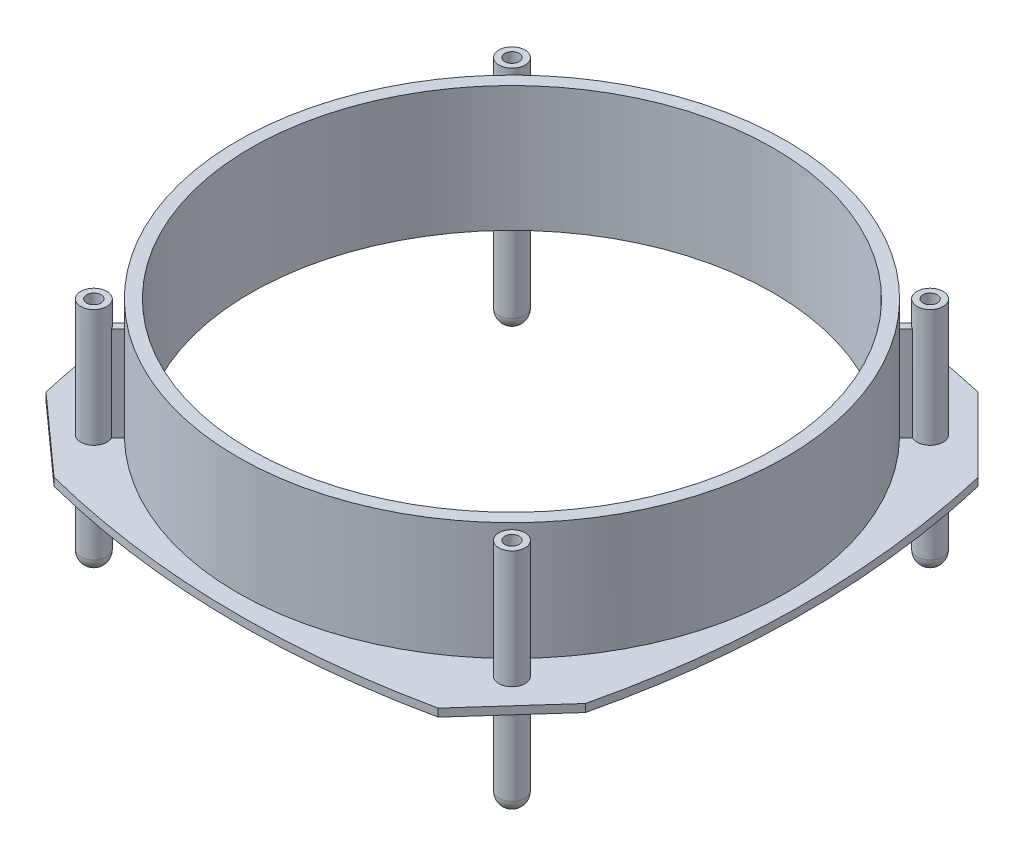
from build123d import *

# Parameters (mm, degrees)
SKETCH2_R                = 5000
BOSS_EXTRUDE2_DEPTH      = 150
SKETCH3_R                = 5244.246539356
BOSS_EXTRUDE3_DEPTH      = 2400
SKETCH4_R                = 5000
CUT_EXTRUDE1_DEPTH       = 3000
SKETCH7_R                = 250
BOSS_EXTRUDE12_DEPTH     = 2400
BOSS_EXTRUDE13_START     = 2000
SKETCH9_R                = 250
BOSS_EXTRUDE13_DEPTH     = 2000
FILLET1_R                = 250
SKETCH10_R               = 137.445591435
CUT_EXTRUDE2_DEPTH       = 500
EXTRUDE_THIN10_DEPTH     = 1800
CIRPATTERN1_COUNT        = 4
FILLET1_OF_CIRPATTERN1_R = 250


with BuildPart() as part:
    # Sketch2 → Boss-Extrude2 (new body)
    with BuildSketch(Plane(origin=(0, 0, 0), x_dir=(1, 0, 0), z_dir=(0, 1, 0))):
        with BuildLine():
            Line((3824.429393628, -5236.727592336), (5157.692676049, -3749.624245316))
            add(Edge.make_bspline(
                [(5163.968520998, 3752.344435712), (6040.866701019, 0.596942764), (5157.692676049, -3749.624245316)],
                knots=[0, 0, 0, 1, 1, 1], degree=2))
            Line((5163.968520998, 3752.344435712), (3751.208948661, 5164.143902966))
            add(Edge.make_bspline(
                [(-3751.770188441, 5163.582833105), (-0.337562444, 6037.385508755), (3751.208948661, 5164.143902966)],
                knots=[0, 0, 0, 1, 1, 1], degree=2))
            Line((-3751.770188441, 5163.582833105), (-5163.707873982, 3750.961398637))
            add(Edge.make_bspline(
                [(-5163.707873982, 3750.961398637), (-6037.549572471, -0.53895869), (-5163.076160475, -3751.919756157)],
                knots=[0, 0, 0, 1, 1, 1], degree=2))
            Line((-5163.076160475, -3751.919756157), (-3675.972813455, -5085.183038578))
            add(Edge.make_bspline(
                [(-3675.972813455, -5085.183038578), (54.671333271, -6041.022726245), (3824.429393628, -5236.727592336)],
                knots=[0, 0, 0, 1, 1, 1], degree=2))
        make_face()
        Circle(SKETCH2_R, mode=Mode.SUBTRACT)
    extrude(amount=BOSS_EXTRUDE2_DEPTH)

    # Sketch3 → Boss-Extrude3 (add)
    with BuildSketch(Plane(origin=(0, 0, 0), x_dir=(1, 0, 0), z_dir=(0, 1, 0))):
        Circle(SKETCH3_R)
    extrude(amount=BOSS_EXTRUDE3_DEPTH)

    # Sketch4 → Cut-Extrude1 (cut)
    with BuildSketch(Plane(origin=(0, 2400, 0), x_dir=(1, 0, 0), z_dir=(0, 1, 0))):
        Circle(SKETCH4_R)
    extrude(amount=-CUT_EXTRUDE1_DEPTH, mode=Mode.SUBTRACT)

    # Sketch7 → Boss-Extrude12 (add)
    with BuildSketch(Plane(origin=(0, 0, 0), x_dir=(-1, 0, 0), z_dir=(0, -1, 0))):
        with Locations((4000, 4000)):
            Circle(SKETCH7_R)
    boss_extrude12 = extrude(amount=-BOSS_EXTRUDE12_DEPTH)

    # Sketch9 → Boss-Extrude13 (add)
    with BuildSketch(Plane(origin=(0, 0, 0), x_dir=(-1, 0, 0), z_dir=(0, -1, 0)).offset(BOSS_EXTRUDE13_START)):
        with Locations((4000, 4000)):
            Circle(SKETCH9_R)
    boss_extrude13 = extrude(amount=-BOSS_EXTRUDE13_DEPTH)

    # Fillet1
    fillet1_edges = [part.edges().sort_by_distance(p)[0] for p in [
        (-3750, 0, -4000),
        (-3750, -2000, -4000),
    ]]
    fillet(fillet1_edges, radius=FILLET1_R)

    # Sketch10 → Cut-Extrude2 (cut)
    with BuildSketch(Plane(origin=(0, 2400, 0), x_dir=(1, 0, 0), z_dir=(0, 1, 0))):
        with Locations((-4000, 4000)):
            Circle(SKETCH10_R)
    cut_extrude2 = extrude(amount=-CUT_EXTRUDE2_DEPTH, mode=Mode.SUBTRACT)

    # Sketch13 → Extrude-Thin10 (add)
    with BuildSketch(Plane(origin=(0, 150, 0), x_dir=(1, 0, 0), z_dir=(0, 1, 0))):
        Polygon((-3779.801572758, 3881.624949249), (-3656.98109375, 3758.804470241), (-3707.892781996, 3707.892781996), (-3830.713261004, 3830.713261004), align=None)
        Polygon((-3758.804470241, 3656.98109375), (-3881.624949249, 3779.801572758), (-3830.713261004, 3830.713261004), (-3707.892781996, 3707.892781996), align=None)
    extrude_thin10 = extrude(amount=EXTRUDE_THIN10_DEPTH)

    # CirPattern1: Boss-Extrude12, Boss-Extrude13, Cut-Extrude2, Extrude-Thin10 ×4 about axis
    cirpattern1_axis = Axis((0, 3250, 0), (0, -1, 0))
    add([boss_extrude12.rotate(cirpattern1_axis, i * 360 / CIRPATTERN1_COUNT) for i in range(1, CIRPATTERN1_COUNT)])
    add([boss_extrude13.rotate(cirpattern1_axis, i * 360 / CIRPATTERN1_COUNT) for i in range(1, CIRPATTERN1_COUNT)])
    add([cut_extrude2.rotate(cirpattern1_axis, i * 360 / CIRPATTERN1_COUNT) for i in range(1, CIRPATTERN1_COUNT)], mode=Mode.SUBTRACT)
    add([extrude_thin10.rotate(cirpattern1_axis, i * 360 / CIRPATTERN1_COUNT) for i in range(1, CIRPATTERN1_COUNT)])

    # Fillet1 of CirPattern1
    fillet1_of_cirpattern1_edges = [part.edges().sort_by_distance(p)[0] for p in [
        (4000, 0, -3750),
        (4000, -2000, -3750),
        (3750, 0, 4000),
        (3750, -2000, 4000),
        (-4000, 0, 3750),
        (-4000, -2000, 3750),
    ]]
    fillet(fillet1_of_cirpattern1_edges, radius=FILLET1_OF_CIRPATTERN1_R)


solid = part.part
